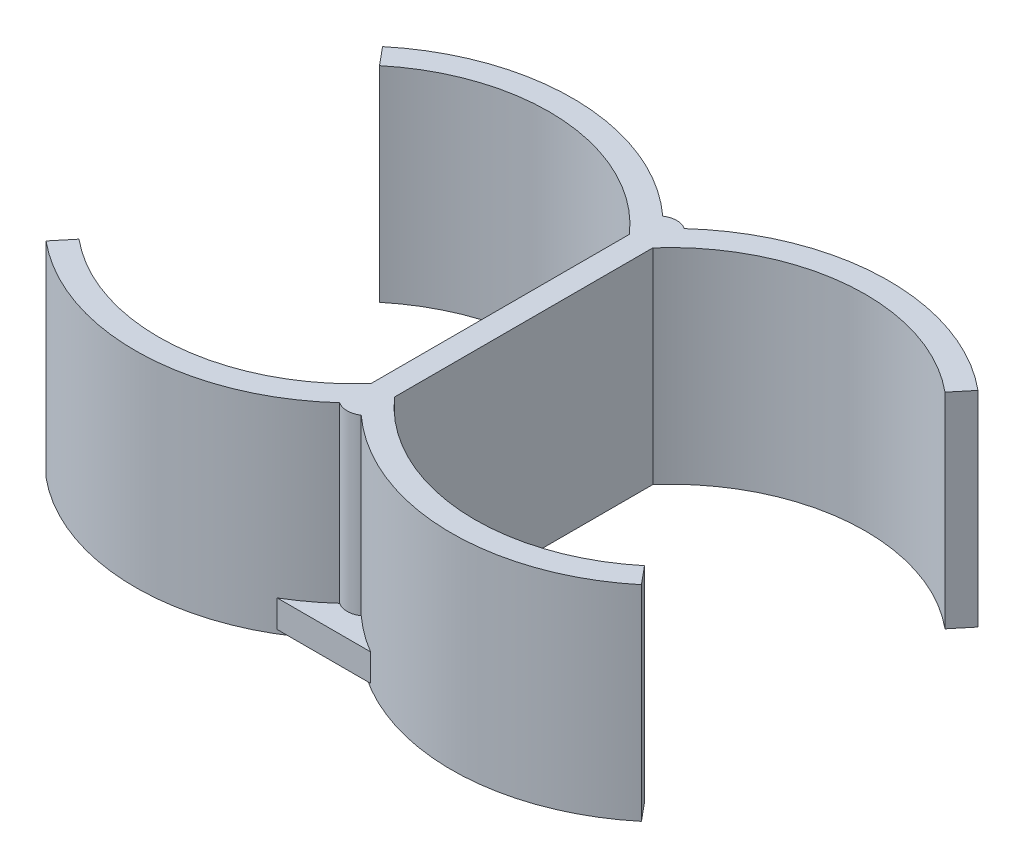
from build123d import *

# Parameters (mm, degrees)
BOSS_EXTRUDE1_DEPTH = 5.25
BOSS_EXTRUDE2_START = -0.2
BOSS_EXTRUDE2_DEPTH = 1.4
SKETCH2_R           = 1
BOSS_EXTRUDE3_DEPTH = 8.9


with BuildPart() as part:
    # Sketch1 → Boss-Extrude1 (new, symmetric)
    with BuildSketch(Plane(origin=(0, 0, 0), x_dir=(1, 0, 0), z_dir=(0, 1, 0))):
        with BuildLine():
            ThreePointArc((0, -7.735559645), (-0.4049689, -7.287992259), (-0.785238344, -6.8192583))
            ThreePointArc((-0.785238344, -6.8192583), (-7.460228587, -9.979548781), (-14.483869819, -7.69670089))
            Line((-14.483869819, -7.69670089), (-15.25, -8.620304997))
            ThreePointArc((-15.25, -8.620304997), (-7.450762238, -11.181198596), (0, -7.735559645))
        make_face()
        with BuildLine():
            ThreePointArc((14.483869819, -7.69670089), (7.460228587, -9.979548781), (0.785238344, -6.8192583))
            ThreePointArc((0.785238344, -6.8192583), (0.4049689, -7.287992259), (0, -7.735559645))
            ThreePointArc((0, -7.735559645), (7.450762238, -11.181198596), (15.25, -8.620304997))
            Line((15.25, -8.620304997), (14.483869819, -7.69670089))
        make_face()
        with BuildLine():
            Line((0.6, -6.615), (-0.6, -6.615))
            ThreePointArc((-0.6, -6.615), (-0.691915101, -6.71776766), (-0.785238344, -6.8192583))
            ThreePointArc((-0.785238344, -6.8192583), (-0.4049689, -7.287992259), (0, -7.735559645))
            ThreePointArc((0, -7.735559645), (0.4049689, -7.287992259), (0.785238344, -6.8192583))
            ThreePointArc((0.785238344, -6.8192583), (0.691915101, -6.71776766), (0.6, -6.615))
        make_face()
        with BuildLine():
            Line((-0.6, 4.93148467), (-0.6, -4.93148467))
            ThreePointArc((-0.6, -4.93148467), (-0.312960425, -5.406599961), (0, -5.865056097))
            ThreePointArc((0, -5.865056097), (0.312960425, -5.406599961), (0.6, -4.93148467))
            Line((0.6, -4.93148467), (0.6, 4.93148467))
            ThreePointArc((0.6, 4.93148467), (0.312960425, 5.406599961), (0, 5.865056097))
            ThreePointArc((0, 5.865056097), (-0.312960425, 5.406599961), (-0.6, 4.93148467))
        make_face()
        with BuildLine():
            ThreePointArc((0, 7.735559645), (-0.4049689, 7.287992259), (-0.785238344, 6.8192583))
            ThreePointArc((-0.785238344, 6.8192583), (-0.691915101, 6.71776766), (-0.6, 6.615))
            Line((-0.6, 6.615), (0.6, 6.615))
            ThreePointArc((0.6, 6.615), (0.691915101, 6.71776766), (0.785238344, 6.8192583))
            ThreePointArc((0.785238344, 6.8192583), (0.4049689, 7.287992259), (0, 7.735559645))
        make_face()
        with BuildLine():
            ThreePointArc((-14.483869819, 7.69670089), (-7.460228587, 9.979548781), (-0.785238344, 6.8192583))
            ThreePointArc((-0.785238344, 6.8192583), (-0.4049689, 7.287992259), (0, 7.735559645))
            ThreePointArc((0, 7.735559645), (-7.450762238, 11.181198596), (-15.25, 8.620304997))
            Line((-15.25, 8.620304997), (-14.483869819, 7.69670089))
        make_face()
        with BuildLine():
            ThreePointArc((15.25, 8.620304997), (7.450762238, 11.181198596), (0, 7.735559645))
            ThreePointArc((0, 7.735559645), (0.4049689, 7.287992259), (0.785238344, 6.8192583))
            ThreePointArc((0.785238344, 6.8192583), (7.460228587, 9.979548781), (14.483869819, 7.69670089))
            Line((14.483869819, 7.69670089), (15.25, 8.620304997))
        make_face()
        with BuildLine():
            ThreePointArc((0, -5.865056097), (-0.290991494, -6.247235392), (-0.6, -6.615))
            Line((-0.6, -6.615), (0.6, -6.615))
            ThreePointArc((0.6, -6.615), (0.290991494, -6.247235392), (0, -5.865056097))
        make_face()
        with BuildLine():
            ThreePointArc((0, -5.865056097), (0.290991494, -6.247235392), (0.6, -6.615))
            Line((0.6, -6.615), (0.6, -4.93148467))
            ThreePointArc((0.6, -4.93148467), (0.312960425, -5.406599961), (0, -5.865056097))
        make_face()
        with BuildLine():
            ThreePointArc((0, 5.865056097), (0.312960425, 5.406599961), (0.6, 4.93148467))
            Line((0.6, 4.93148467), (0.6, 6.615))
            ThreePointArc((0.6, 6.615), (0.290991494, 6.247235392), (0, 5.865056097))
        make_face()
        with BuildLine():
            Line((-0.6, -4.93148467), (-0.6, -6.615))
            ThreePointArc((-0.6, -6.615), (-0.290991494, -6.247235392), (0, -5.865056097))
            ThreePointArc((0, -5.865056097), (-0.312960425, -5.406599961), (-0.6, -4.93148467))
        make_face()
        with BuildLine():
            Line((-0.6, 6.615), (-0.6, 4.93148467))
            ThreePointArc((-0.6, 4.93148467), (-0.312960425, 5.406599961), (0, 5.865056097))
            ThreePointArc((0, 5.865056097), (-0.290991494, 6.247235392), (-0.6, 6.615))
        make_face()
        with BuildLine():
            Line((0.6, 6.615), (-0.6, 6.615))
            ThreePointArc((-0.6, 6.615), (-0.290991494, 6.247235392), (0, 5.865056097))
            ThreePointArc((0, 5.865056097), (0.290991494, 6.247235392), (0.6, 6.615))
        make_face()
    extrude(amount=BOSS_EXTRUDE1_DEPTH, both=True)

    # Sketch3 → Boss-Extrude2 (add)
    with BuildSketch(Plane.XZ.offset(5.25).offset(BOSS_EXTRUDE2_START)):
        Polygon((0, -7.735559645), (2.39016182, -9.635559645), (-2.39016182, -9.635559645), align=None)
        Polygon((0, 7.735559645), (2.39016182, 9.635559645), (-2.39016182, 9.635559645), align=None)
    extrude(amount=-BOSS_EXTRUDE2_DEPTH)

    # Sketch2 → Boss-Extrude3 (add)
    with BuildSketch(Plane(origin=(0, 5.25, 0), x_dir=(1, 0, 0), z_dir=(0, 1, 0))):
        with Locations((0, 7.443042592)):
            Circle(SKETCH2_R)
        with Locations((0, -7.443042592)):
            Circle(SKETCH2_R)
    extrude(amount=-BOSS_EXTRUDE3_DEPTH)


solid = part.part
